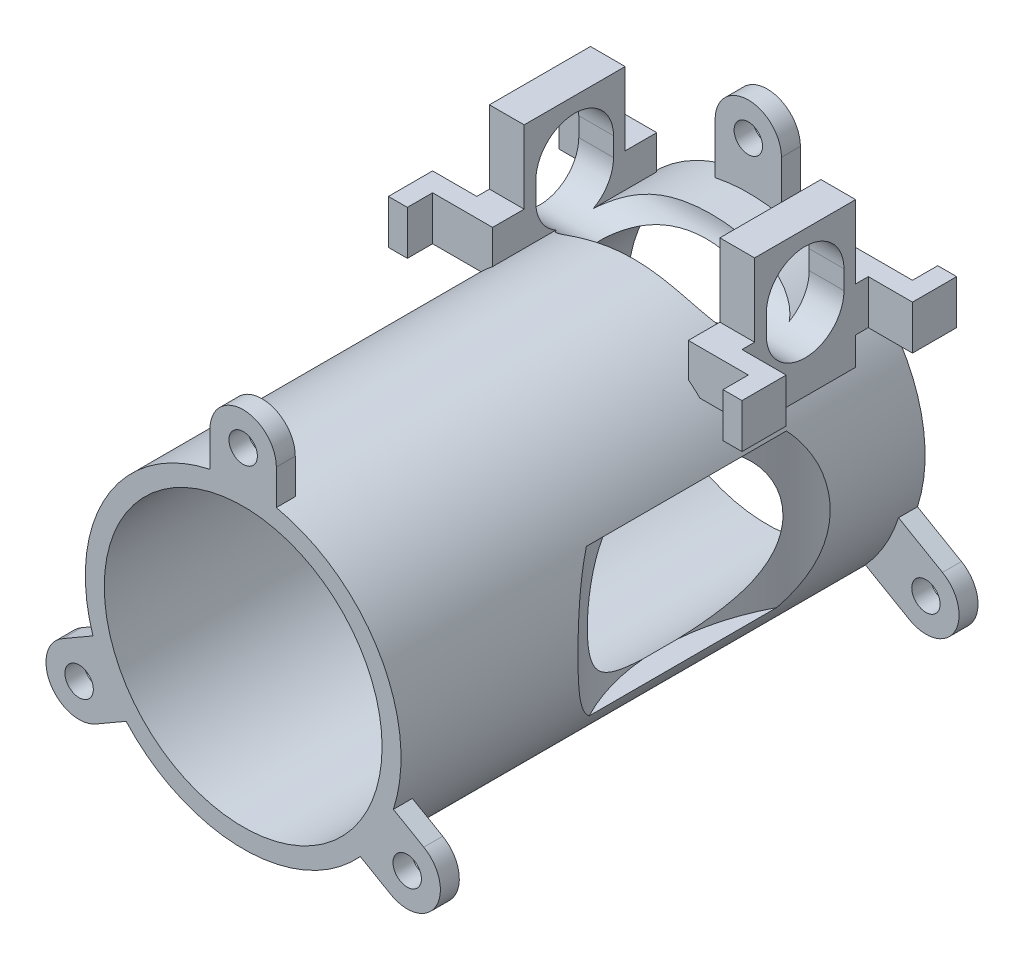
from build123d import *

# Parameters (mm, degrees)
SKETCH1_R                 = 25
SKETCH1_R_2               = 22
BOSS_EXTRUDE1_DEPTH       = 30
SKETCH3_R                 = 6.15
CUT_EXTRUDE1_DEPTH        = 25
SKETCH7_R                 = 25
SKETCH7_R_2               = 22
BOSS_EXTRUDE4_DEPTH       = 53
SKETCH9_R                 = 2.25
BOSS_EXTRUDE5_DEPTH       = 3
CIRPATTERN1_COUNT         = 3
BOSS_EXTRUDE6_START       = -3
SKETCH10_R                = 2.25
BOSS_EXTRUDE6_DEPTH       = 3
CIRPATTERN2_COUNT         = 3
BOSS_EXTRUDE7_DEPTH       = 8
CUT_EXTRUDE5_START        = -16
CUT_EXTRUDE5_DEPTH        = 16
SKETCH17_W                = 3
SKETCH17_H                = 4
SKETCH17_W_2              = 5.5
SKETCH17_H_2              = 2
BOSS_EXTRUDE8_DEPTH       = 7
MIRROR2_COPY_1_SKETCH_W   = 3
MIRROR2_COPY_1_SKETCH_H   = 4
MIRROR2_COPY_1_SKETCH_W_2 = 5.5
MIRROR2_COPY_1_SKETCH_H_2 = 2
MIRROR2_COPY_1_DEPTH      = 7
SKETCH12_R                = 32
CUT_EXTRUDE4_DEPTH        = 24


with BuildPart() as part:
    # Sketch1 → Boss-Extrude1 (new body)
    with BuildSketch(Plane.XY):
        Circle(SKETCH1_R)
        Circle(SKETCH1_R_2, mode=Mode.SUBTRACT)
    extrude(amount=BOSS_EXTRUDE1_DEPTH)

    # Sketch3 → Cut-Extrude1 (cut, symmetric)
    with BuildSketch(Plane(origin=(0, 0, 0), x_dir=(0, 0, -1), z_dir=(1, 0, 0))):
        with Locations((-15, 25)):
            Circle(SKETCH3_R)
    extrude(amount=CUT_EXTRUDE1_DEPTH, both=True, mode=Mode.SUBTRACT)

    # Sketch7 → Boss-Extrude4 (add)
    with BuildSketch(Plane.XY.offset(30)):
        Circle(SKETCH7_R)
        Circle(SKETCH7_R_2, mode=Mode.SUBTRACT)
    extrude(amount=BOSS_EXTRUDE4_DEPTH)

    # Sketch9 → Boss-Extrude5 (add)
    with BuildSketch(Plane(origin=(0, 0, 0), x_dir=(-1, 0, 0), z_dir=(0, 0, -1))):
        with BuildLine():
            Line((5.25, 24.442534648), (5.25, 32.484665375))
            ThreePointArc((5.25, 32.484665375), (0, 37.734665375), (-5.25, 32.484665375))
            Line((-5.25, 32.484665375), (-5.25, 24.442534648))
            ThreePointArc((-5.25, 24.442534648), (0, 25), (5.25, 24.442534648))
        make_face()
        with Locations((0, 32.484665375)):
            Circle(SKETCH9_R, mode=Mode.SUBTRACT)
    boss_extrude5 = extrude(amount=-BOSS_EXTRUDE5_DEPTH)

    # CirPattern1: Boss-Extrude5 ×3 about axis
    cirpattern1_axis = Axis((0, 0, 0), (0, 0, 1))
    for i in range(1, CIRPATTERN1_COUNT):
        add(boss_extrude5.rotate(cirpattern1_axis, i * 360 / CIRPATTERN1_COUNT))

    # Sketch10 → Boss-Extrude6 (add)
    with BuildSketch(Plane.XY.offset(83).offset(BOSS_EXTRUDE6_START)):
        with BuildLine():
            ThreePointArc((-5.25, 24.442534648), (0, 25), (5.25, 24.442534648))
            Line((5.25, 24.442534648), (5.25, 30))
            ThreePointArc((5.25, 30), (0, 35.25), (-5.25, 30))
            Line((-5.25, 30), (-5.25, 24.442534648))
        make_face()
        with Locations((0, 30)):
            Circle(SKETCH10_R, mode=Mode.SUBTRACT)
    boss_extrude6 = extrude(amount=BOSS_EXTRUDE6_DEPTH)

    # CirPattern2: Boss-Extrude6 ×3 about axis
    cirpattern2_axis = Axis((0, 0, 0), (0, 0, 1))
    for i in range(1, CIRPATTERN2_COUNT):
        add(boss_extrude6.rotate(cirpattern2_axis, i * 360 / CIRPATTERN2_COUNT))

    # Sketch14 → Boss-Extrude7 (add, symmetric)
    with BuildSketch(Plane.XY.offset(15)):
        with BuildLine():
            Line((-21, 13.564659966), (-21, 36.564659966))
            Line((-21, 36.564659966), (-15.5, 36.564659966))
            Line((-15.5, 36.564659966), (-15.5, 19.615045246))
            ThreePointArc((-15.5, 19.615045246), (-18.499034853, 16.816233511), (-21, 13.564659966))
        make_face()
    boss_extrude7 = extrude(amount=BOSS_EXTRUDE7_DEPTH, both=True)

    # Sketch15 → Cut-Extrude5 (cut)
    with BuildSketch(Plane.ZY.offset(21).offset(CUT_EXTRUDE5_START)):
        with BuildLine():
            Line((8.85, 25), (8.85, 28))
            ThreePointArc((8.85, 28), (15, 34.15), (21.15, 28))
            Line((21.15, 28), (21.15, 25))
            ThreePointArc((21.15, 25), (15, 18.85), (8.85, 25))
        make_face()
    cut_extrude5 = extrude(amount=CUT_EXTRUDE5_DEPTH, mode=Mode.SUBTRACT)

    # Sketch17 → Boss-Extrude8 (add)
    with BuildSketch(Plane(origin=(0, 25, 0), x_dir=(1, 0, 0), z_dir=(0, 1, 0))):
        with Locations((-26.5, -30)):
            Rectangle(SKETCH17_W, SKETCH17_H)
        Polygon((-15.5, -28), (-15.5, -25), (-21, -25), (-28, -25), (-28, -28), (-25, -28), align=None)
        with Locations((-18.25, -24)):
            Rectangle(SKETCH17_W_2, SKETCH17_H_2)
    boss_extrude8 = extrude(amount=-BOSS_EXTRUDE8_DEPTH)

    # Mirror1: Boss-Extrude8 across plane
    add(boss_extrude8.mirror(Plane.XY.offset(15)))

    # Mirror2: Boss-Extrude7, Cut-Extrude5, Boss-Extrude8 across plane
    add(boss_extrude7.mirror(Plane(origin=(0, 0, 0), x_dir=(0, 0, 1), z_dir=(1, 0, 0))))
    add(cut_extrude5.mirror(Plane(origin=(0, 0, 0), x_dir=(0, 0, 1), z_dir=(1, 0, 0))), mode=Mode.SUBTRACT)
    add(boss_extrude8.mirror(Plane(origin=(0, 0, 0), x_dir=(0, 0, 1), z_dir=(1, 0, 0))))

    # Mirror2 copy 1 sketch → Mirror2 copy 1 (add)
    with BuildSketch(Plane(origin=(0, 25, 30), x_dir=(-1, 0, 0), z_dir=(0, 1, 0))):
        with Locations((-26.5, -30)):
            Rectangle(MIRROR2_COPY_1_SKETCH_W, MIRROR2_COPY_1_SKETCH_H)
        Polygon((-15.5, -28), (-15.5, -25), (-21, -25), (-28, -25), (-28, -28), (-25, -28), align=None)
        with Locations((-18.25, -24)):
            Rectangle(MIRROR2_COPY_1_SKETCH_W_2, MIRROR2_COPY_1_SKETCH_H_2)
    extrude(amount=-MIRROR2_COPY_1_DEPTH)

    # Sketch12 → Cut-Extrude4 (cut)
    with BuildSketch(Plane(origin=(0, 11.51, 0), x_dir=(1, 0, 0), z_dir=(0, 1, 0))):
        with Locations((-50, -35)):
            Circle(SKETCH12_R)
        with Locations((50, -35)):
            Circle(SKETCH12_R)
    extrude(amount=-CUT_EXTRUDE4_DEPTH, mode=Mode.SUBTRACT)


solid = part.part
